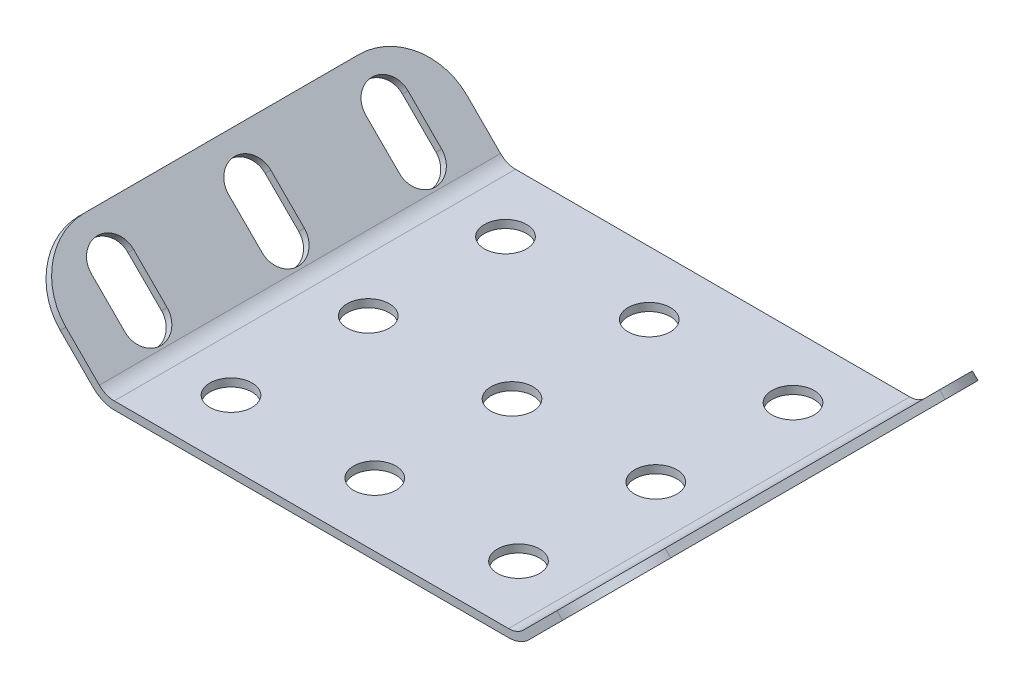
from build123d import *
from build123d.topology import SkipClean

# Parameters (mm, degrees)
ESTRUSIONE_SOTTILE1_DEPTH = 19
SCHIZZO2_R                = 2
TAGLIO_ESTRUSIONE2_DEPTH  = 10
TAGLIO_ESTRUSIONE3_DEPTH  = 10
RACCORDO1_R               = 6


with BuildPart() as part:
    # Schizzo1 → Estrusione-Sottile1 (new, symmetric)
    with BuildSketch(Plane.XY):
        with BuildLine():
            Line((-27.5, 8), (-20.085786438, 0.585786438))
            ThreePointArc((-20.085786438, 0.585786438), (-19.43693974, 0.152240935), (-18.671572875, 0))
            Line((-18.671572875, 0), (0, 0))
            Line((0, 0), (0, -0.75))
            Line((0, -0.75), (-18.671572875, -0.75))
            ThreePointArc((-18.671572875, -0.75), (-19.723952314, -0.540668714), (-20.616116524, 0.055456352))
            Line((-20.616116524, 0.055456352), (-28.030330086, 7.469669914))
            Line((-28.030330086, 7.469669914), (-27.5, 8))
        make_face()
    extrude(amount=ESTRUSIONE_SOTTILE1_DEPTH, both=True)

    # Schizzo2 → Taglio-Estrusione2 (cut)
    with BuildSketch(Plane.XZ.offset(0.75)):
        with Locations(Location((-13.616116524, -13, 0), (0, 0, 270))):
            Circle(SCHIZZO2_R)
        with Locations((0, -13)):
            Circle(SCHIZZO2_R)
        with Locations(Location((-13.616116524, 0, 0), (0, 0, 270))):
            Circle(SCHIZZO2_R)
        Circle(SCHIZZO2_R)
        with Locations((0, 13)):
            Circle(SCHIZZO2_R)
        with Locations(Location((-13.616116524, 13, 0), (0, 0, 270))):
            Circle(SCHIZZO2_R)
    extrude(amount=-TAGLIO_ESTRUSIONE2_DEPTH, mode=Mode.SUBTRACT)

    # Schizzo3 → Taglio-Estrusione3 (cut)
    with BuildSketch(Plane(origin=(-9.75, -9.75, 0), x_dir=(0, 0, -1), z_dir=(0.7071067811865487, 0.7071067811865465, 0))):
        with BuildLine():
            Line((-11, 21.352290732), (-11, 16.852290732))
            ThreePointArc((-11, 16.852290732), (-13, 14.852290732), (-15, 16.852290732))
            Line((-15, 16.852290732), (-15, 21.352290732))
            ThreePointArc((-15, 21.352290732), (-13, 23.352290732), (-11, 21.352290732))
        make_face()
        with BuildLine():
            Line((2, 21.352290732), (2, 16.852290732))
            ThreePointArc((2, 16.852290732), (0, 14.852290732), (-2, 16.852290732))
            Line((-2, 16.852290732), (-2, 21.352290732))
            ThreePointArc((-2, 21.352290732), (0, 23.352290732), (2, 21.352290732))
        make_face()
        with BuildLine():
            Line((11, 16.852290732), (11, 21.352290732))
            ThreePointArc((11, 21.352290732), (13, 23.352290732), (15, 21.352290732))
            Line((15, 21.352290732), (15, 16.852290732))
            ThreePointArc((15, 16.852290732), (13, 14.852290732), (11, 16.852290732))
        make_face()
    extrude(amount=-TAGLIO_ESTRUSIONE3_DEPTH, mode=Mode.SUBTRACT)

    # Raccordo1
    raccordo1_edges = [part.edges().sort_by_distance(p)[0] for p in [
        (-27.765165043, 7.734834957, 19),
        (-27.765165043, 7.734834957, -19),
    ]]
    fillet(raccordo1_edges, radius=RACCORDO1_R)

    # Specchia1: part across plane


with BuildPart() as part_1:
    with SkipClean():  # the faces are left unmerged after this step: merging them gives an invalid solid
        add(part.part)
        add(part.part.mirror(Plane(origin=(0, 0, 19), x_dir=(0, 0, 1), z_dir=(1, 0, 0))))


solid = part_1.part
